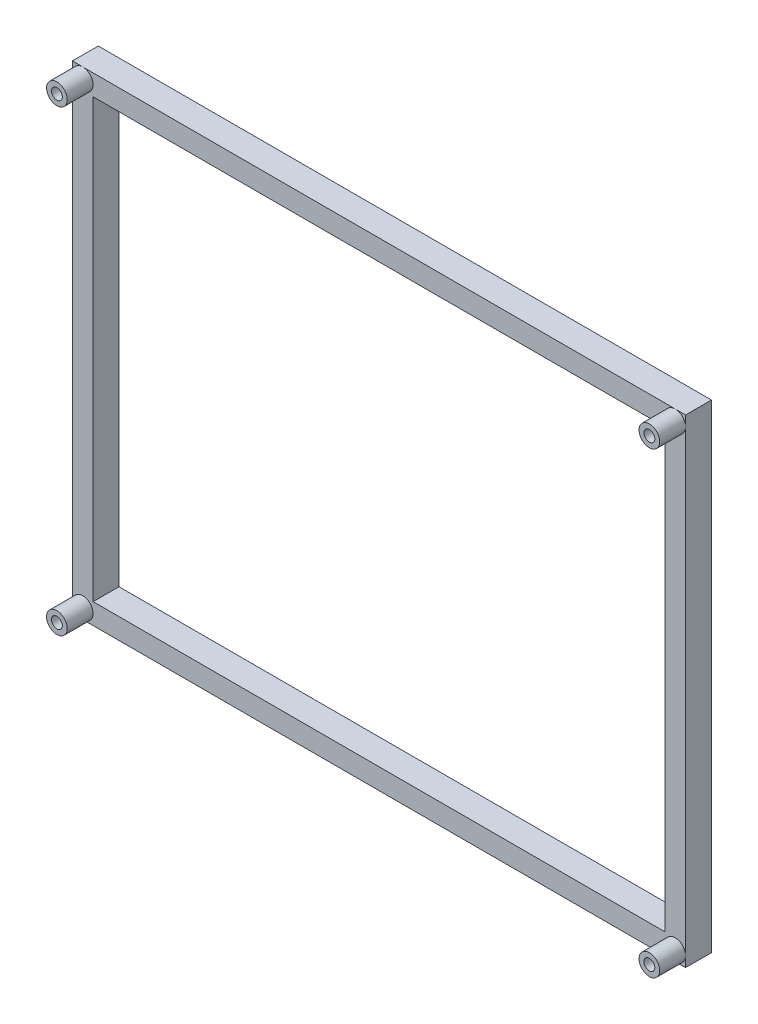
from build123d import *

# Parameters (mm, degrees)
SKETCH1_W           = 118.5
SKETCH1_H           = 92.5
SKETCH1_W_2         = 110.5
SKETCH1_H_2         = 84.5
BOSS_EXTRUDE1_DEPTH = 5
SKETCH2_R           = 2
SKETCH2_R_2         = 1.05
BOSS_EXTRUDE2_DEPTH = 5


with BuildPart() as part:
    # Sketch1 → Boss-Extrude1 (new body)
    with BuildSketch(Plane.XY):
        with Locations((59.25, 46.25)):
            Rectangle(SKETCH1_W, SKETCH1_H)
        with Locations((59.25, 46.25)):
            Rectangle(SKETCH1_W_2, SKETCH1_H_2, mode=Mode.SUBTRACT)
    extrude(amount=-BOSS_EXTRUDE1_DEPTH)

    # Sketch2 → Boss-Extrude2 (add)
    # profile 1 of 4: a face of its own
    with BuildSketch(Plane.XY):
        with Locations(Location((2, 90.5, 0), (0, 0, 180))):
            Circle(SKETCH2_R)
        with Locations((2, 90.5)):
            Circle(SKETCH2_R_2, mode=Mode.SUBTRACT)
    # profile 2 of 4: a face of its own
    with BuildSketch(Plane.XY):
        with Locations((116.5, 90.5)):
            Circle(SKETCH2_R)
        with Locations((116.5, 90.5)):
            Circle(SKETCH2_R_2, mode=Mode.SUBTRACT)
    # profile 3 of 4: a face of its own
    with BuildSketch(Plane.XY):
        with Locations((116.5, 2)):
            Circle(SKETCH2_R)
        with Locations((116.5, 2)):
            Circle(SKETCH2_R_2, mode=Mode.SUBTRACT)
    # profile 4 of 4: a face of its own
    with BuildSketch(Plane.XY):
        with Locations(Location((2, 2, 0), (0, 0, 180))):
            Circle(SKETCH2_R)
        with Locations((2, 2)):
            Circle(SKETCH2_R_2, mode=Mode.SUBTRACT)
    extrude(amount=BOSS_EXTRUDE2_DEPTH)


solid = part.part
